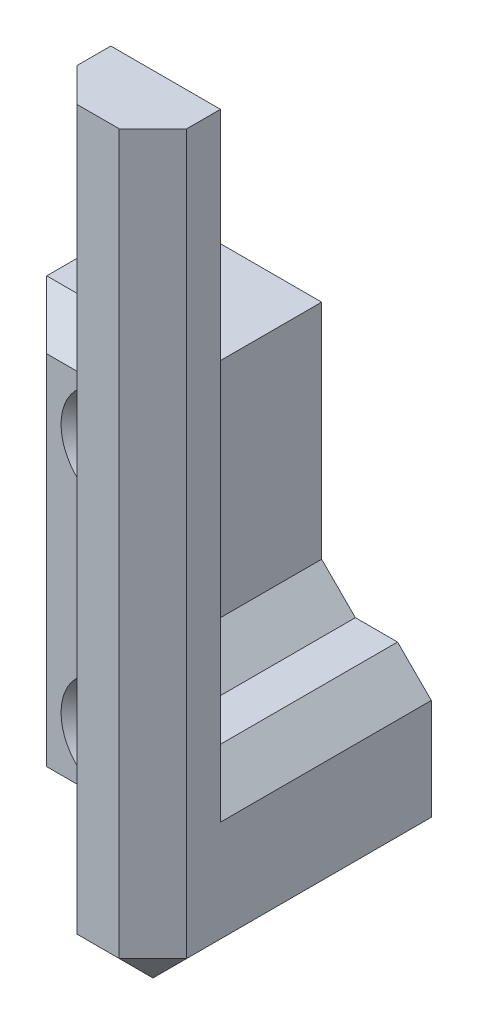
from build123d import *

# Parameters (mm, degrees)
SKETCH1_R                       = 1.6
BOSS_EXTRUDE1_DEPTH             = 8.8
SKETCH2_W                       = 6.5
SKETCH2_H                       = 10
BOSS_EXTRUDE2_DEPTH             = 3.7
BOSS_EXTRUDE2_DIRECTION_2_REACH = 30.332
SKETCH3_W                       = 6.5
SKETCH3_H                       = 44.6
BOSS_EXTRUDE3_DEPTH             = 4
CHAMFER1_SIZE                   = 2
CHAMFER2_SIZE                   = 1.55


with BuildPart() as part:
    # Sketch1 → Boss-Extrude1 (new body)
    with BuildSketch(Plane.XY):
        Polygon((0, 0), (8, 0), (9.5, 0), (9.5, 25.2), (8, 25.2), (0, 25.2), align=None)
        with Locations((6, 20)):
            Circle(SKETCH1_R, mode=Mode.SUBTRACT)
        with Locations(Location((6, 5.2, 0), (0, 0, 180))):
            Circle(SKETCH1_R, mode=Mode.SUBTRACT)
    extrude(amount=BOSS_EXTRUDE1_DEPTH)

    # Sketch2 → Boss-Extrude2 (add)
    with BuildSketch(Plane.XY.offset(8.8)):
        with Locations((12.75, 5)):
            Rectangle(SKETCH2_W, SKETCH2_H)
    extrude(amount=BOSS_EXTRUDE2_DEPTH)

    # Boss-Extrude2 direction 2: up to this face of the body (flat: up to its plane)
    boss_extrude2_direction_2_end = Plane(part.part.faces().sort_by_distance((4.659964898, 12.6, 0))[0])
    # Sketch2 → Boss-Extrude2 direction 2 (add, up to the picked face)
    with BuildSketch(Plane.XY.offset(8.8), mode=Mode.PRIVATE) as boss_extrude2_direction_2_sk1:
        with Locations((12.75, 5)):
            Rectangle(SKETCH2_W, SKETCH2_H)
    boss_extrude2_direction_2_tool1 = split(extrude(boss_extrude2_direction_2_sk1.sketch, amount=-BOSS_EXTRUDE2_DIRECTION_2_REACH, mode=Mode.PRIVATE), bisect_by=boss_extrude2_direction_2_end, keep=Keep.BOTH, mode=Mode.PRIVATE)
    add(boss_extrude2_direction_2_tool1.solids().sort_by(Axis((12.75, 5, 8.8), (0, 0, -1)))[0])

    # Sketch3 → Boss-Extrude3 (add)
    with BuildSketch(Plane.XY.offset(12.5)):
        with Locations((12.75, 22.3)):
            Rectangle(SKETCH3_W, SKETCH3_H)
    extrude(amount=BOSS_EXTRUDE3_DEPTH)

    # Chamfer1
    chamfer1_edges = [part.edges().sort_by_distance(p)[0] for p in [
        (4.75, 25.2, 8.8),
        (9.5, 0, 12.65),
        (16, 0, 8.25),
        (16, 10, 6.25),
        (9.5, 10, 4.4),
        (9.5, 22.3, 16.5),
        (12.75, 0, 16.5),
        (16, 22.3, 16.5),
        (0, 12.6, 8.8),
        (4.75, 0, 8.8),
    ]]
    chamfer(chamfer1_edges, length=CHAMFER1_SIZE)

    # Chamfer2
    chamfer2_edges = [part.edges().sort_by_distance(p)[0] for p in [
        (4.4, 20, 8.8),
        (7.6, 5.2, 8.8),
    ]]
    chamfer(chamfer2_edges, length=CHAMFER2_SIZE)


solid = part.part
